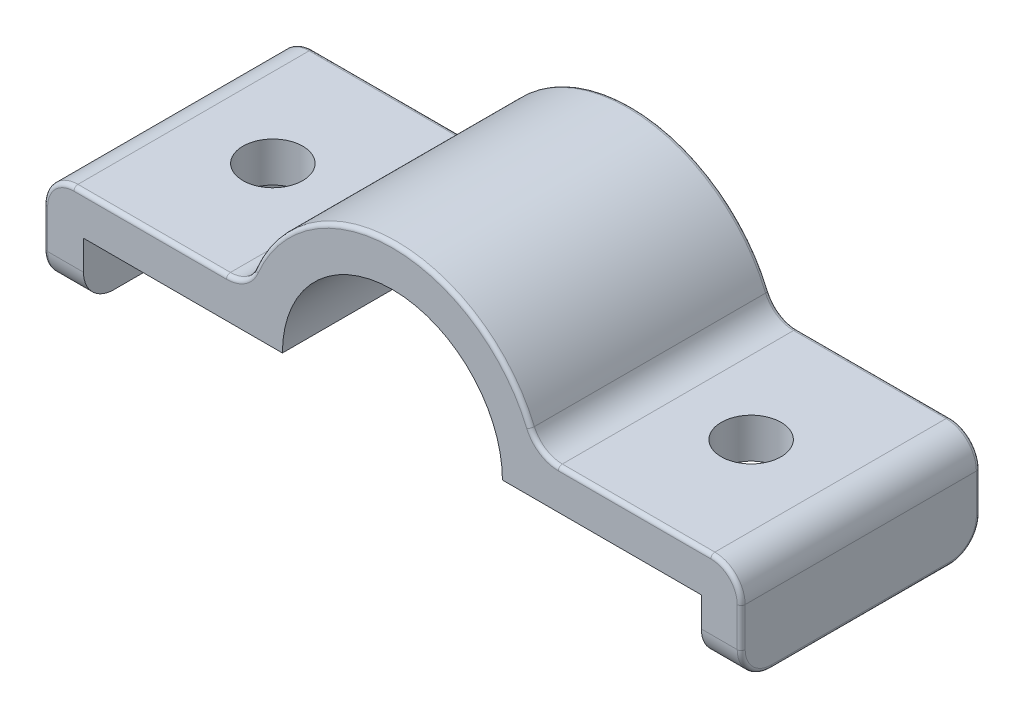
from build123d import *

# Parameters (mm, degrees)
BOSS_EXTRUDE1_DEPTH = 38.1
SKETCH3_R           = 9.525
CUT_EXTRUDE1_DEPTH  = 123.592896731
FILLET1_R           = 9.652
FILLET2_R           = 1.27


with BuildPart() as part:
    # Sketch1 → Boss-Extrude1 (new, symmetric)
    with BuildSketch(Plane.XY):
        with BuildLine():
            Line((-35.052, 0), (-98.425, 0))
            Line((-98.425, 0), (-98.425, -19.05))
            Line((-98.425, -19.05), (-111.125, -19.05))
            Line((-111.125, -19.05), (-111.125, 12.7))
            Line((-111.125, 12.7), (-46.032200729, 12.7))
            ThreePointArc((-46.032200729, 12.7), (0, 47.752), (46.032200729, 12.7))
            Line((46.032200729, 12.7), (111.125, 12.7))
            Line((111.125, 12.7), (111.125, -19.05))
            Line((111.125, -19.05), (98.425, -19.05))
            Line((98.425, -19.05), (98.425, 0))
            Line((98.425, 0), (35.052, 0))
            ThreePointArc((35.052, 0), (0, 35.052), (-35.052, 0))
        make_face()
    extrude(amount=BOSS_EXTRUDE1_DEPTH, both=True)

    # Sketch3 → Cut-Extrude1 (cut, through all)
    with BuildSketch(Plane(origin=(0, 12.7, 0), x_dir=(1, 0, 0), z_dir=(0, 1, 0))):
        with Locations(Location((-76.2, 0, 0), (0, 0, 180))):
            Circle(SKETCH3_R)
        with Locations(Location((76.2, 0, 0), (0, 0, 180))):
            Circle(SKETCH3_R)
    extrude(amount=-CUT_EXTRUDE1_DEPTH, mode=Mode.SUBTRACT)

    # Fillet1
    fillet1_edges = [part.edges().sort_by_distance(p)[0] for p in [
        (-104.775, -19.05, -38.1),
        (104.775, -19.05, -38.1),
        (104.775, -19.05, 38.1),
        (-111.125, 12.7, 0),
        (-46.032200729, 12.7, 0),
        (46.032200729, 12.7, 0),
        (111.125, 12.7, 0),
        (-104.775, -19.05, 38.1),
    ]]
    fillet(fillet1_edges, radius=FILLET1_R)

    # Fillet2
    fillet2_edges = [part.edges().sort_by_distance(p)[0] for p in [
        (111.125, -19.05, 0),
        (111.125, -3.175, -38.1),
        (111.125, -3.175, 38.1),
        (111.125, -16.222994652, 35.272994652),
        (111.125, -16.222994652, -35.272994652),
        (-111.125, -3.175, -38.1),
        (-77.173251465, 12.7, -38.1),
        (0, 47.752, -38.1),
        (77.173251465, 12.7, -38.1),
        (108.297994652, 9.872994652, -38.1),
        (-108.297994652, 9.872994652, -38.1),
        (-111.125, -19.05, 0),
        (-111.125, -3.175, 38.1),
        (-111.125, -16.222994652, 35.272994652),
        (-111.125, -16.222994652, -35.272994652),
        (-77.173251465, 12.7, 38.1),
        (0, 47.752, 38.1),
        (77.173251465, 12.7, 38.1),
        (108.297994652, 9.872994652, 38.1),
        (-108.297994652, 9.872994652, 38.1),
        (-47.540305771, 14.307243194, -38.1),
        (-47.540305771, 14.307243194, 38.1),
        (47.540305771, 14.307243194, -38.1),
        (47.540305771, 14.307243194, 38.1),
    ]]
    fillet(fillet2_edges, radius=FILLET2_R)


solid = part.part
